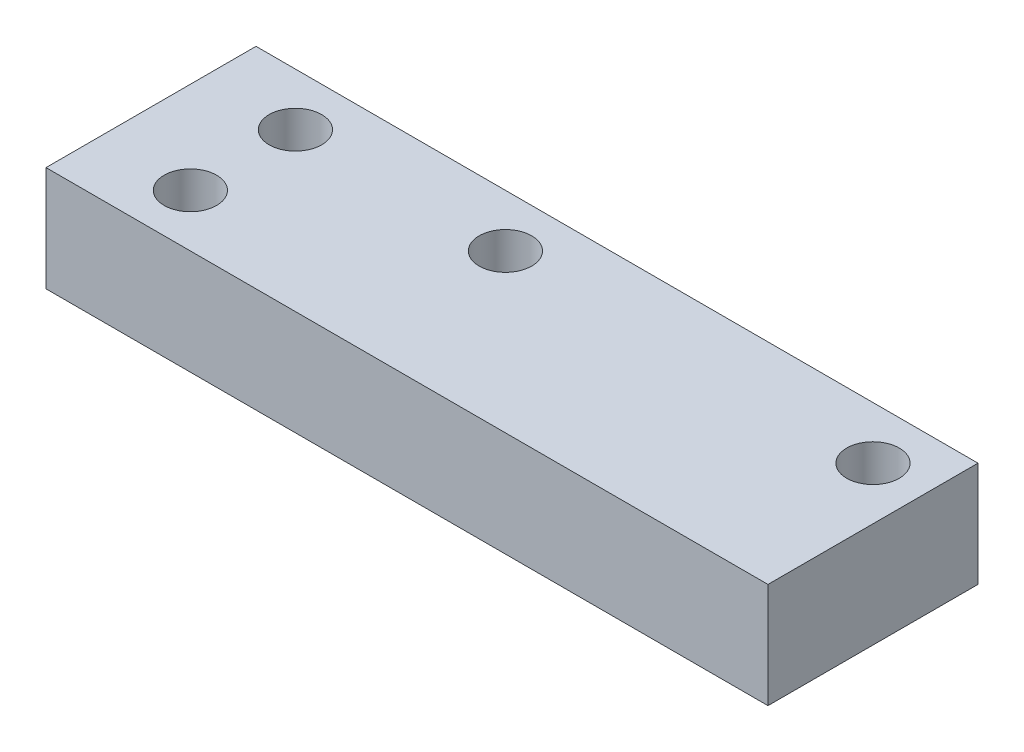
from build123d import *

# Parameters (mm, degrees)
SKETCH2_W           = 55
SKETCH2_H           = 16
SKETCH2_R           = 2
BOSS_EXTRUDE1_DEPTH = 8


with BuildPart() as part:
    # Sketch2 → Boss-Extrude1 (new body)
    with BuildSketch(Plane(origin=(0, 0, 0), x_dir=(1, 0, 0), z_dir=(0, 1, 0))):
        with Locations((27.5, -8)):
            Rectangle(SKETCH2_W, SKETCH2_H)
        with Locations(Location((23, -4, 0), (0, 0, 270))):
            Circle(SKETCH2_R, mode=Mode.SUBTRACT)
        with Locations(Location((51, -4, 0), (0, 0, 270))):
            Circle(SKETCH2_R, mode=Mode.SUBTRACT)
        with Locations(Location((7, -4, 0), (0, 0, 270))):
            Circle(SKETCH2_R, mode=Mode.SUBTRACT)
        with Locations(Location((7, -12, 0), (0, 0, 270))):
            Circle(SKETCH2_R, mode=Mode.SUBTRACT)
    extrude(amount=BOSS_EXTRUDE1_DEPTH)


solid = part.part
